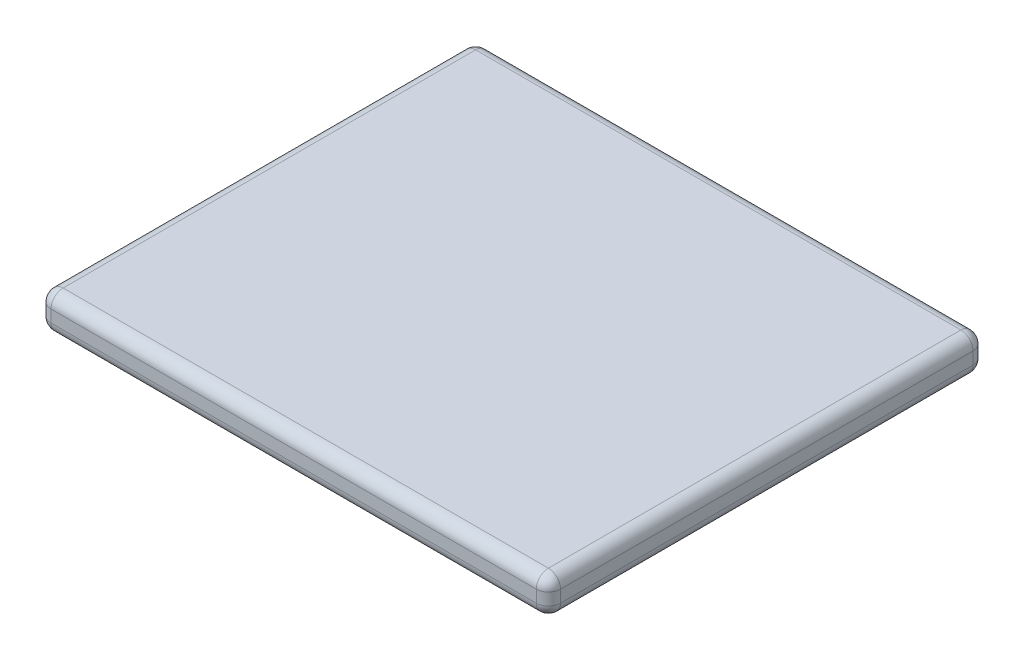
from build123d import *

# Parameters (mm, degrees)
BOSS_EXTRUDE1_DEPTH = 6
FILLET1_R           = 2


with BuildPart() as part:
    # Sketch1 → Boss-Extrude1 (new body)
    with BuildSketch(Plane(origin=(0, 0, 0), x_dir=(1, 0, 0), z_dir=(0, 1, 0))):
        with BuildLine():
            Line((-40, 36), (40, 36))
            ThreePointArc((40, 36), (41.414213562, 35.414213562), (42, 34))
            Line((42, 34), (42, -34))
            ThreePointArc((42, -34), (41.414213562, -35.414213562), (40, -36))
            Line((40, -36), (-40, -36))
            ThreePointArc((-40, -36), (-41.414213562, -35.414213562), (-42, -34))
            Line((-42, -34), (-42, 34))
            ThreePointArc((-42, 34), (-41.414213562, 35.414213562), (-40, 36))
        make_face()
    extrude(amount=BOSS_EXTRUDE1_DEPTH)

    # Fillet1
    fillet1_edges = [part.edges().sort_by_distance(p)[0] for p in [
        (41.414213562, 6, 35.414213562),
        (0, 0, 36),
        (-41.414213562, 0, 35.414213562),
        (42, 6, 0),
        (41.414213562, 6, -35.414213562),
        (0, 6, -36),
        (-41.414213562, 6, -35.414213562),
        (-42, 6, 0),
        (-41.414213562, 6, 35.414213562),
        (0, 6, 36),
        (-42, 0, 0),
        (-41.414213562, 0, -35.414213562),
        (0, 0, -36),
        (41.414213562, 0, -35.414213562),
        (42, 0, 0),
        (41.414213562, 0, 35.414213562),
    ]]
    fillet(fillet1_edges, radius=FILLET1_R)


solid = part.part
